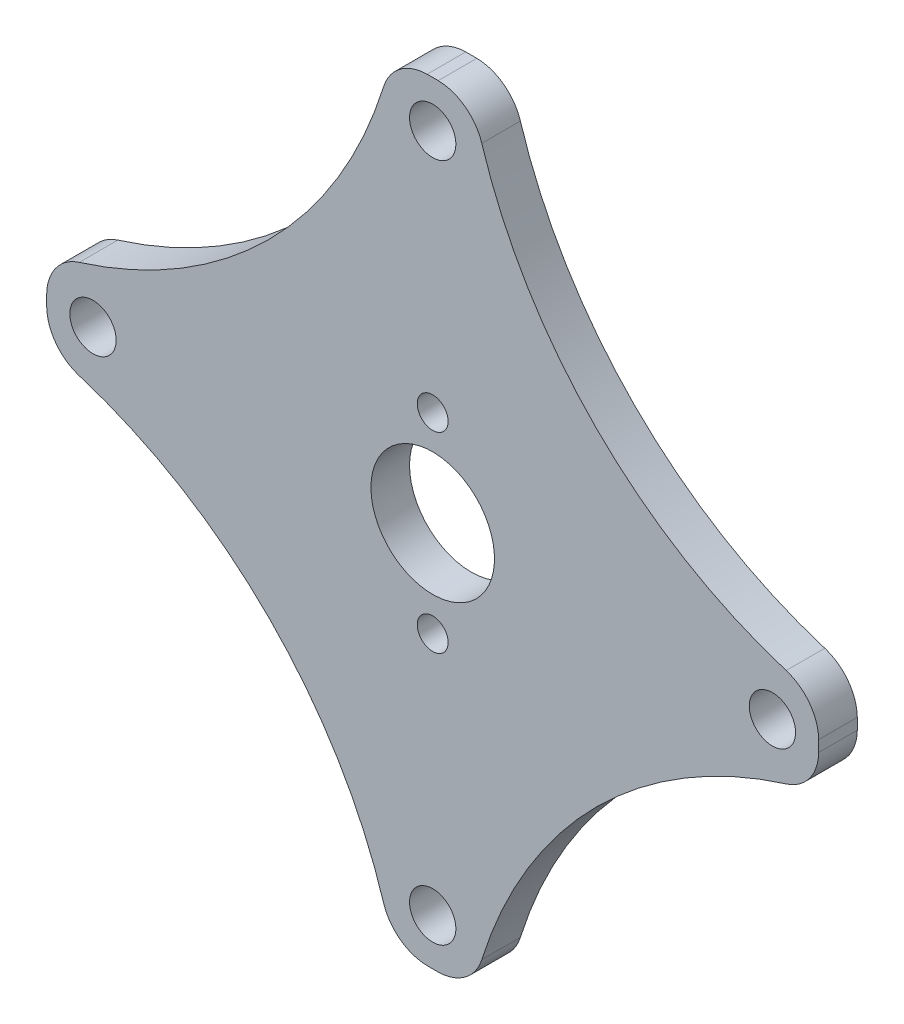
from build123d import *

# Parameters (mm, degrees)
SKETCH_1_R               = 25
SKETCH_1_R_2             = 1.5
EXTRUDE_1_DEPTH          = 2.5
CUT_EXTRUDE_2_DEPTH      = 36.443617197
CUT_EXTRUDE_2_DEPTH_BACK = 36.443617197
SKETCH_3_R               = 1
SKETCH_3_R_2             = 4
CUT_EXTRUDE_5_DEPTH      = 10
FILLET_2_R               = 3


with BuildPart() as part:
    # 草图1 → 凸台-拉伸1 (new body)
    with BuildSketch(Plane.XY):
        Circle(SKETCH_1_R)
        with Locations((0, 22)):
            Circle(SKETCH_1_R_2, mode=Mode.SUBTRACT)
        with Locations((22, 0)):
            Circle(SKETCH_1_R_2, mode=Mode.SUBTRACT)
        with Locations((0, -22)):
            Circle(SKETCH_1_R_2, mode=Mode.SUBTRACT)
        with Locations(Location((-22, 0, 0), (0, 0, 180))):
            Circle(SKETCH_1_R_2, mode=Mode.SUBTRACT)
    extrude(amount=EXTRUDE_1_DEPTH)

    # 草图3 → 切除-拉伸2 (cut, two sides: drawn at the far end of the back side and taken through both)
    with BuildSketch(Plane(origin=(0, 0, 0), x_dir=(-1, 0, 0), z_dir=(0, 0, -1)).offset(-CUT_EXTRUDE_2_DEPTH_BACK)):
        with Locations((0, 6.2)):
            Circle(SKETCH_3_R)
        Circle(SKETCH_3_R_2)
        with Locations((0, -6.2)):
            Circle(SKETCH_3_R)
    extrude(amount=CUT_EXTRUDE_2_DEPTH + CUT_EXTRUDE_2_DEPTH_BACK, mode=Mode.SUBTRACT)

    # 草图5 → 切除-拉伸5 (cut)
    with BuildSketch(Plane(origin=(0, 0, 0), x_dir=(-1, 0, 0), z_dir=(0, 0, -1))):
        with BuildLine():
            ThreePointArc((-2.638187412, 24.860409634), (-17.67766953, 17.67766953), (-24.860409634, 2.638187412))
            ThreePointArc((-24.860409634, 2.638187412), (-10.606601718, 10.606601718), (-2.638187412, 24.860409634))
        make_face()
        with BuildLine():
            ThreePointArc((-2.638187412, -24.860409634), (-10.606601718, -10.606601718), (-24.860409634, -2.638187412))
            ThreePointArc((-24.860409634, -2.638187412), (-17.67766953, -17.67766953), (-2.638187412, -24.860409634))
        make_face()
        with BuildLine():
            ThreePointArc((24.860409634, -2.638187412), (10.606601718, -10.606601718), (2.638187412, -24.860409634))
            ThreePointArc((2.638187412, -24.860409634), (17.67766953, -17.67766953), (24.860409634, -2.638187412))
        make_face()
        with BuildLine():
            ThreePointArc((24.860409634, 2.638187412), (17.67766953, 17.67766953), (2.638187412, 24.860409634))
            ThreePointArc((2.638187412, 24.860409634), (10.606601718, 10.606601718), (24.860409634, 2.638187412))
        make_face()
    extrude(amount=-CUT_EXTRUDE_5_DEPTH, mode=Mode.SUBTRACT)

    # 圆角2
    fillet_2_edges = [part.edges().sort_by_distance(p)[0] for p in [
        (2.638187412, 24.860409634, 1.25),
        (24.860409634, 2.638187412, 1.25),
        (24.860409634, -2.638187412, 1.25),
        (2.638187412, -24.860409634, 1.25),
        (-2.638187412, -24.860409634, 1.25),
        (-24.860409634, -2.638187412, 1.25),
        (-24.860409634, 2.638187412, 1.25),
        (-2.638187412, 24.860409634, 1.25),
    ]]
    fillet(fillet_2_edges, radius=FILLET_2_R)


solid = part.part
